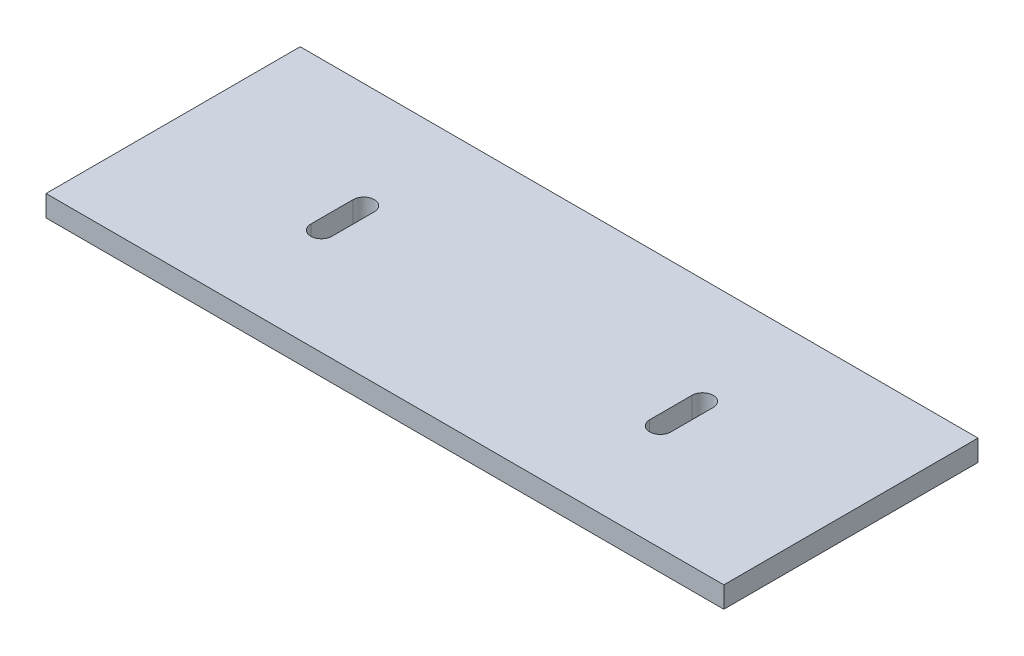
from build123d import *

# Parameters (mm, degrees)
SKETCH1_W           = 203.2
SKETCH1_H           = 76.2
BOSS_EXTRUDE1_DEPTH = 6.35


with BuildPart() as part:
    # Sketch1 → Boss-Extrude1 (new body)
    with BuildSketch(Plane(origin=(0, 0, 0), x_dir=(1, 0, 0), z_dir=(0, 1, 0))):
        Rectangle(SKETCH1_W, SKETCH1_H)
        with BuildLine():
            Line((-53.975, -6.35), (-53.975, 6.35))
            ThreePointArc((-53.975, 6.35), (-50.8, 9.525), (-47.625, 6.35))
            Line((-47.625, 6.35), (-47.625, -6.35))
            ThreePointArc((-47.625, -6.35), (-50.8, -9.525), (-53.975, -6.35))
        make_face(mode=Mode.SUBTRACT)
        with BuildLine():
            Line((53.975, -6.35), (53.975, 6.35))
            ThreePointArc((53.975, 6.35), (50.8, 9.525), (47.625, 6.35))
            Line((47.625, 6.35), (47.625, -6.35))
            ThreePointArc((47.625, -6.35), (50.8, -9.525), (53.975, -6.35))
        make_face(mode=Mode.SUBTRACT)
    extrude(amount=BOSS_EXTRUDE1_DEPTH)


solid = part.part
